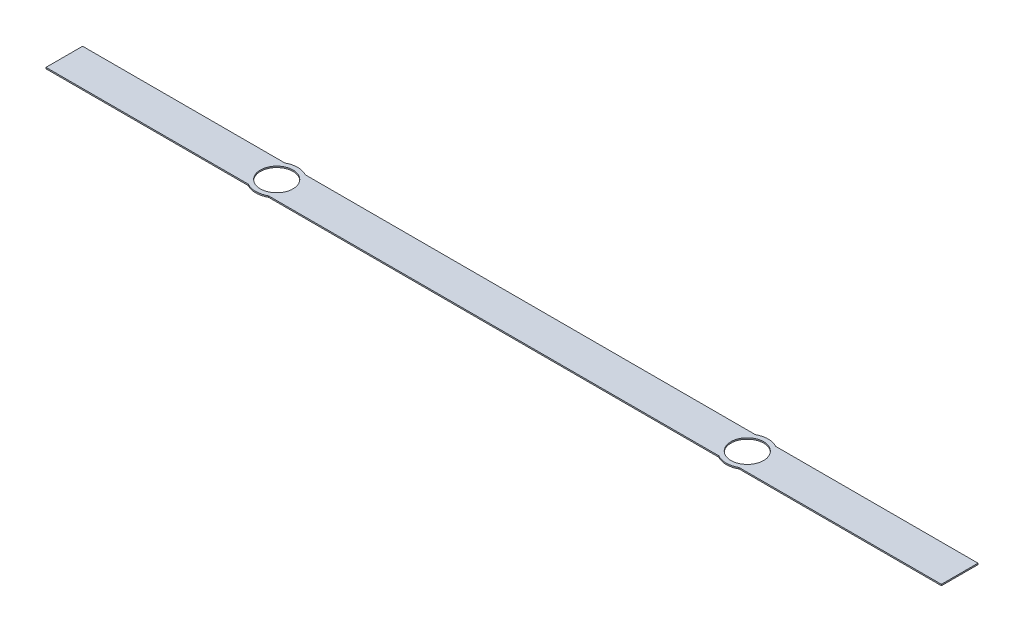
from build123d import *

# Parameters (mm, degrees)
SKETCH1_R           = 1.25
BOSS_EXTRUDE1_DEPTH = 0.1


with BuildPart() as part:
    # Sketch1 → Boss-Extrude1 (new body)
    with BuildSketch(Plane(origin=(0, 0, 0), x_dir=(1, 0, 0), z_dir=(0, 1, 0))):
        with BuildLine():
            Line((-34.25, 1.4), (-18.774596669, 1.4))
            ThreePointArc((-18.774596669, 1.4), (-18, 1.6), (-17.225403331, 1.4))
            Line((-17.225403331, 1.4), (17.225403331, 1.4))
            ThreePointArc((17.225403331, 1.4), (18, 1.6), (18.774596669, 1.4))
            Line((18.774596669, 1.4), (34.25, 1.4))
            Line((34.25, 1.4), (34.25, -1.4))
            Line((34.25, -1.4), (18.774596669, -1.4))
            ThreePointArc((18.774596669, -1.4), (18, -1.6), (17.225403331, -1.4))
            Line((17.225403331, -1.4), (-17.225403331, -1.4))
            ThreePointArc((-17.225403331, -1.4), (-18, -1.6), (-18.774596669, -1.4))
            Line((-18.774596669, -1.4), (-34.25, -1.4))
            Line((-34.25, -1.4), (-34.25, 1.4))
        make_face()
        with Locations(Location((-18, 0, 0), (0, 0, 270))):
            Circle(SKETCH1_R, mode=Mode.SUBTRACT)
        with Locations(Location((18, 0, 0), (0, 0, 90))):
            Circle(SKETCH1_R, mode=Mode.SUBTRACT)
    extrude(amount=BOSS_EXTRUDE1_DEPTH)


solid = part.part
